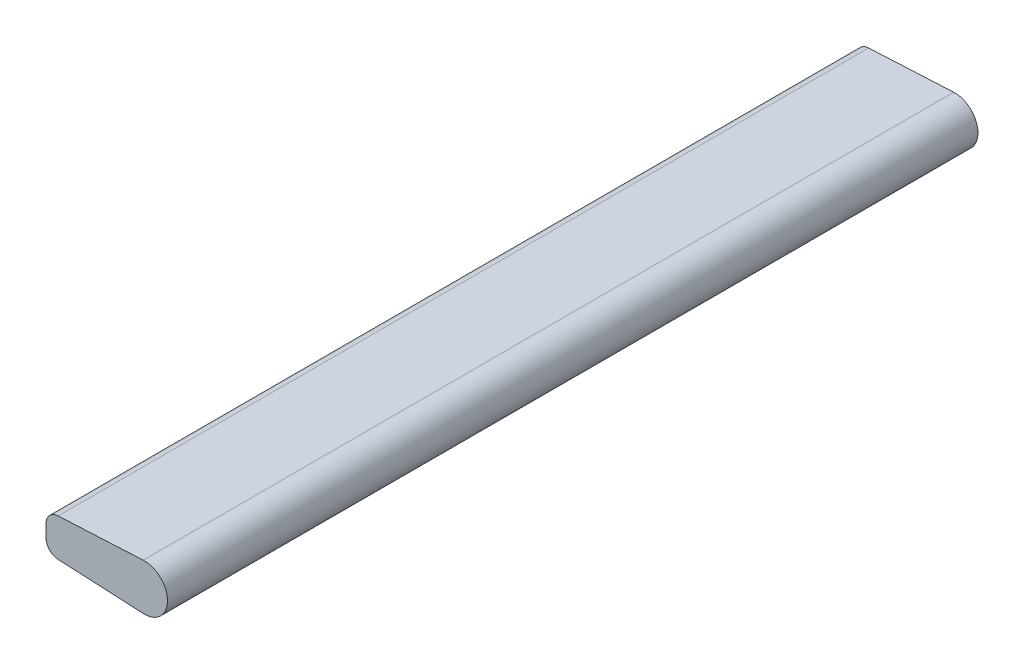
from build123d import *

# Parameters (mm, degrees)
BOSS_EXTRUDE1_DEPTH = 100


with BuildPart() as part:
    # Sketch1 → Boss-Extrude1 (new, symmetric)
    with BuildSketch(Plane.XY):
        with BuildLine():
            Line((-13.496435042, -1.5), (-13.496435042, 1.5))
            ThreePointArc((-13.496435042, 1.5), (-12.627675159, 3.673771087), (-10.5, 4.65))
            Line((-10.5, 4.65), (10.5, 5.7))
            ThreePointArc((10.5, 5.7), (16.492120552, 0), (10.5, -5.7))
            Line((10.5, -5.7), (-10.5, -4.65))
            ThreePointArc((-10.5, -4.65), (-12.627675159, -3.673771087), (-13.496435042, -1.5))
        make_face()
    extrude(amount=BOSS_EXTRUDE1_DEPTH, both=True)


solid = part.part
